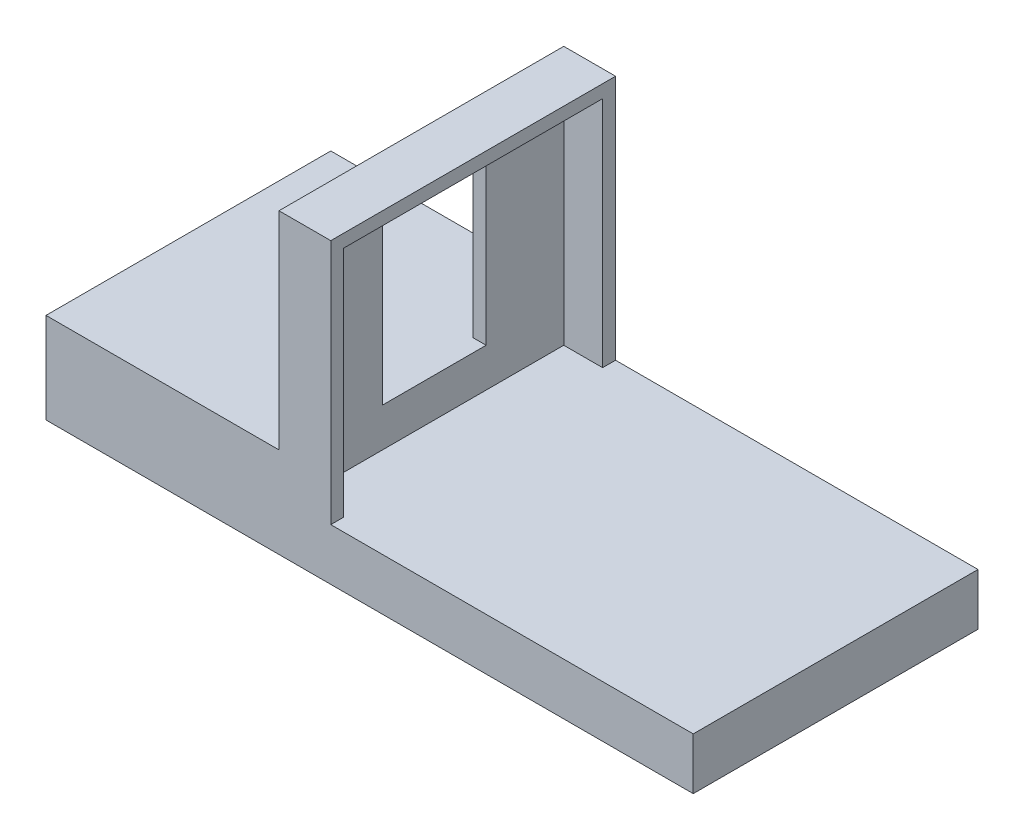
from build123d import *

# Parameters (mm, degrees)
SKETCH1_W           = 250
SKETCH1_H           = 110
BOSS_EXTRUDE1_DEPTH = 20
SKETCH2_W           = 110
SKETCH2_H           = 110
BOSS_EXTRUDE2_DEPTH = 15
SKETCH3_W           = 20
SKETCH3_H           = 110
BOSS_EXTRUDE3_DEPTH = 80
SKETCH4_W           = 40
SKETCH4_H           = 65.596067404
CUT_EXTRUDE1_DEPTH  = 80
SKETCH6_W           = 240
SKETCH6_H           = 100
CUT_EXTRUDE2_DEPTH  = 15
SKETCH7_W           = 85
SKETCH7_H           = 100
CUT_EXTRUDE3_DEPTH  = 15
SKETCH9_W           = 17.224689948
SKETCH9_H           = 100
CUT_EXTRUDE4_DEPTH  = 95
SKETCH10_W          = 17.224689948
SKETCH10_H          = 100
BOSS_EXTRUDE4_DEPTH = 5


with BuildPart() as part:
    # Sketch1 → Boss-Extrude1 (new body)
    with BuildSketch(Plane(origin=(0, 0, 0), x_dir=(1, 0, 0), z_dir=(0, 1, 0))):
        Rectangle(SKETCH1_W, SKETCH1_H)
    extrude(amount=BOSS_EXTRUDE1_DEPTH)

    # Sketch2 → Boss-Extrude2 (add)
    with BuildSketch(Plane(origin=(0, 20, 0), x_dir=(1, 0, 0), z_dir=(0, 1, 0))):
        with Locations((-70, 0)):
            Rectangle(SKETCH2_W, SKETCH2_H)
    extrude(amount=BOSS_EXTRUDE2_DEPTH)

    # Sketch3 → Boss-Extrude3 (add)
    with BuildSketch(Plane(origin=(0, 35, 0), x_dir=(1, 0, 0), z_dir=(0, 1, 0))):
        with Locations((-25, 0)):
            Rectangle(SKETCH3_W, SKETCH3_H)
    extrude(amount=BOSS_EXTRUDE3_DEPTH)

    # Sketch4 → Cut-Extrude1 (cut)
    with BuildSketch(Plane.ZY.offset(35)):
        with Locations((0, 67.798033702)):
            Rectangle(SKETCH4_W, SKETCH4_H)
    extrude(amount=-CUT_EXTRUDE1_DEPTH, mode=Mode.SUBTRACT)

    # Sketch6 → Cut-Extrude2 (cut)
    with BuildSketch(Plane.XZ):
        Rectangle(SKETCH6_W, SKETCH6_H)
    extrude(amount=-CUT_EXTRUDE2_DEPTH, mode=Mode.SUBTRACT)

    # Sketch7 → Cut-Extrude3 (cut)
    with BuildSketch(Plane(origin=(0, 15, 0), x_dir=(-1, 0, 0), z_dir=(0, -1, 0))):
        with Locations((77.5, 0)):
            Rectangle(SKETCH7_W, SKETCH7_H)
    extrude(amount=-CUT_EXTRUDE3_DEPTH, mode=Mode.SUBTRACT)

    # Sketch9 → Cut-Extrude4 (cut)
    with BuildSketch(Plane.XZ.offset(-15)):
        with Locations((-21.387655026, 0)):
            Rectangle(SKETCH9_W, SKETCH9_H)
    extrude(amount=-CUT_EXTRUDE4_DEPTH, mode=Mode.SUBTRACT)

    # Sketch10 → Boss-Extrude4 (add)
    with BuildSketch(Plane(origin=(0, 15, 0), x_dir=(-1, 0, 0), z_dir=(0, -1, 0))):
        with Locations((21.387655026, 0)):
            Rectangle(SKETCH10_W, SKETCH10_H)
    extrude(amount=-BOSS_EXTRUDE4_DEPTH)


solid = part.part
